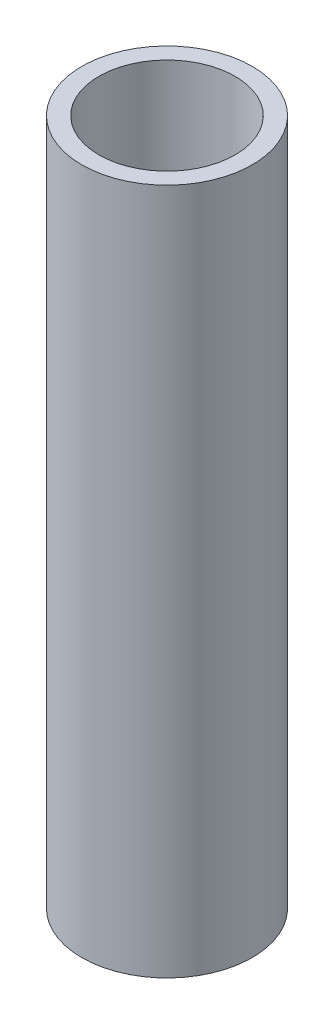
from build123d import *

# Parameters (mm, degrees)
SKETCH1_R           = 12.4187
BOSS_EXTRUDE1_DEPTH = 100
SKETCH1_3_R         = 9.9187
CUT_EXTRUDE1_DEPTH  = 30


with BuildPart() as part:
    # Sketch1 → Boss-Extrude1 (new body)
    with BuildSketch(Plane(origin=(0, 0, 0), x_dir=(1, 0, 0), z_dir=(0, 1, 0))):
        Circle(SKETCH1_R)
    extrude(amount=-BOSS_EXTRUDE1_DEPTH)

    # Sketch1<3> → Cut-Extrude1 (cut)
    with BuildSketch(Plane(origin=(0, 0, 0), x_dir=(1, 0, 0), z_dir=(0, 1, 0))):
        Circle(SKETCH1_3_R)
    extrude(amount=-CUT_EXTRUDE1_DEPTH, mode=Mode.SUBTRACT)


solid = part.part
